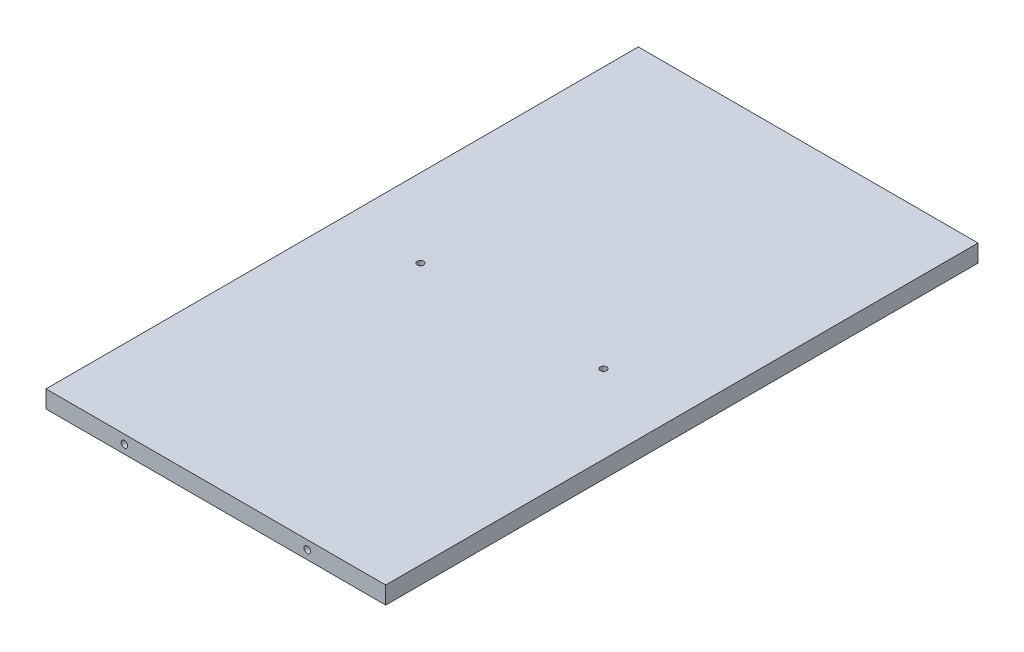
from build123d import *

# Parameters (mm, degrees)
ESQUISSE1_W                  = 390
ESQUISSE1_H                  = 20
BOSS_EXTRU_1_DEPTH           = 680
ENL_V_MAT_EXTRU_1_DEPTH      = 11
ENL_V_MAT_EXTRU_1_DEPTH_BACK = 20
ESQUISSE2_R                  = 3.75
ENL_V_START                  = -20
ESQUISSE4_R                  = 3.75
ENL_V_MAT_EXTRU_2_DEPTH      = 20
ESQUISSE5_R                  = 3.75
ENL_V_MAT_EXTRU_3_DEPTH      = 35


with BuildPart() as part:
    # Esquisse1 → Boss.-Extru.1 (new body)
    with BuildSketch(Plane.XY):
        Rectangle(ESQUISSE1_W, ESQUISSE1_H)
    extrude(amount=BOSS_EXTRU_1_DEPTH)

    # Esquisse2 → Enlèv. mat.-Extru.1 (cut, two sides: drawn at the far end of the back side and taken through both)
    with BuildSketch(Plane.XY.offset(680).offset(-ENL_V_MAT_EXTRU_1_DEPTH_BACK)):
        with Locations(Location((-105, 0, 0), (0, 0, 180))):
            Circle(ESQUISSE2_R)
        with Locations(Location((105, 0, 0), (0, 0, 180))):
            Circle(ESQUISSE2_R)
    extrude(amount=ENL_V_MAT_EXTRU_1_DEPTH + ENL_V_MAT_EXTRU_1_DEPTH_BACK, mode=Mode.SUBTRACT)

    # Esquisse4 → Enlèv. mat.-Extru.2 (cut)
    with BuildSketch(Plane(origin=(0, 0, 0), x_dir=(-1, 0, 0), z_dir=(0, 0, -1)).offset(ENL_V_START)):
        with Locations((-105, 0)):
            Circle(ESQUISSE4_R)
        with Locations((105, 0)):
            Circle(ESQUISSE4_R)
    extrude(amount=ENL_V_MAT_EXTRU_2_DEPTH, mode=Mode.SUBTRACT)

    # Esquisse5 → Enlèv. mat.-Extru.3 (cut)
    with BuildSketch(Plane(origin=(0, 10, 0), x_dir=(1, 0, 0), z_dir=(0, 1, 0))):
        with Locations(Location((-105, -340, 0), (0, 0, 270))):
            Circle(ESQUISSE5_R)
        with Locations(Location((105, -340, 0), (0, 0, 270))):
            Circle(ESQUISSE5_R)
    extrude(amount=-ENL_V_MAT_EXTRU_3_DEPTH, mode=Mode.SUBTRACT)


solid = part.part
